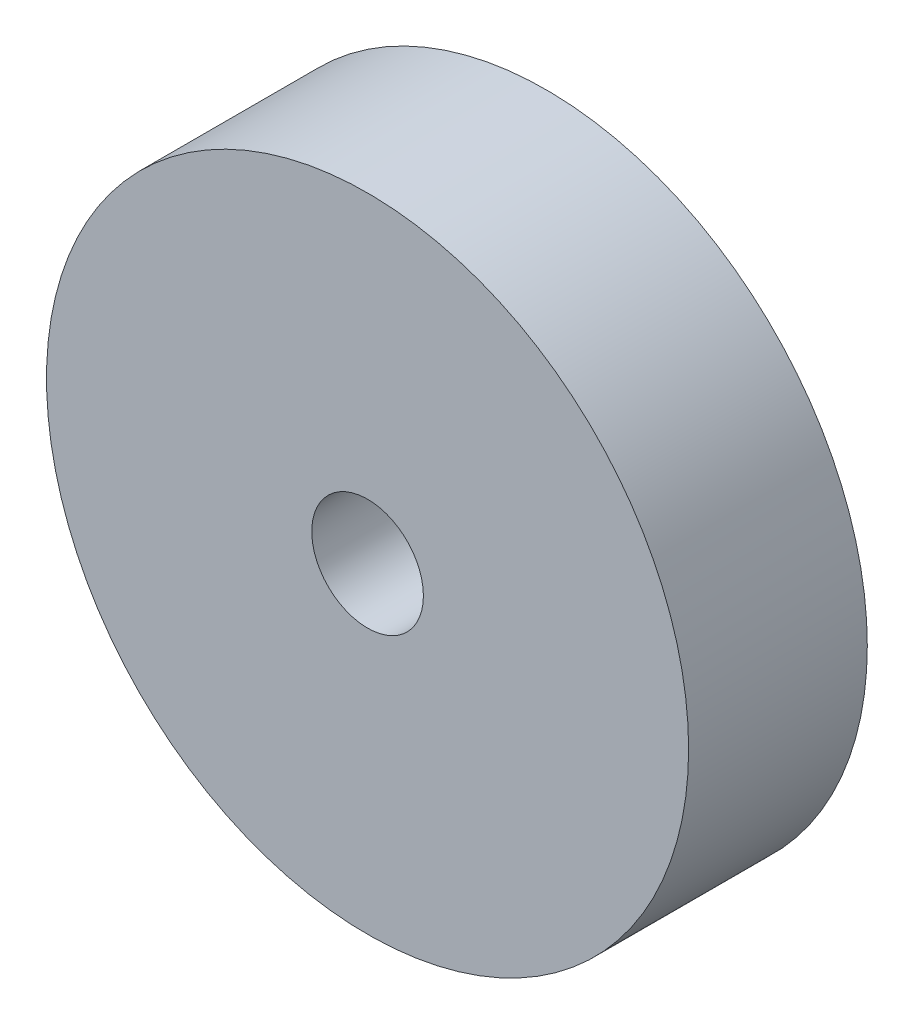
from build123d import *

# Parameters (mm, degrees)
SKETCH2_R           = 36.5125
SKETCH2_R_2         = 6.35
BOSS_EXTRUDE1_DEPTH = 20.32


with BuildPart() as part:
    # Sketch2 → Boss-Extrude1 (new body)
    with BuildSketch(Plane.XY):
        Circle(SKETCH2_R)
        Circle(SKETCH2_R_2, mode=Mode.SUBTRACT)
    extrude(amount=BOSS_EXTRUDE1_DEPTH)


solid = part.part
